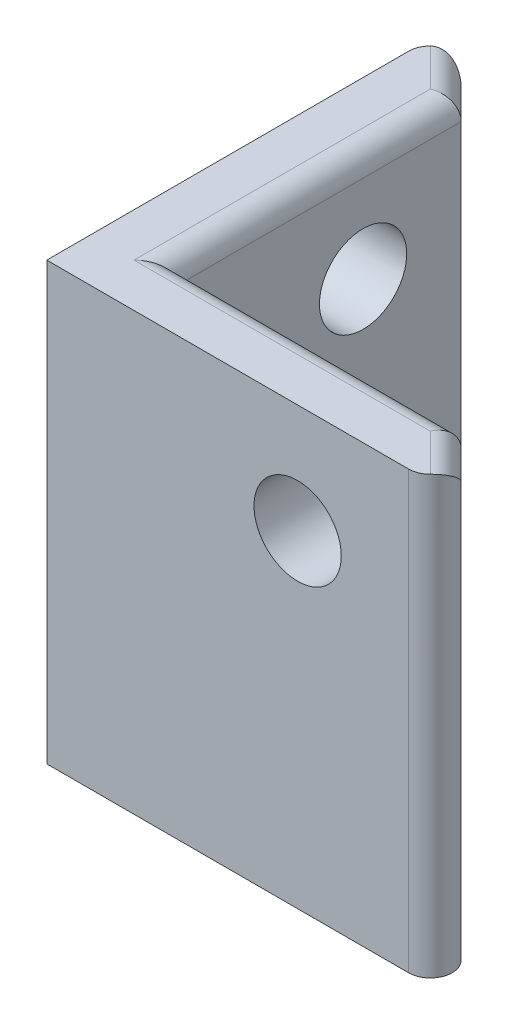
from build123d import *

# Parameters (mm, degrees)
BOSS_EXTRUDE1_DEPTH = 5
BOSS_EXTRUDE2_DEPTH = 15
SKETCH3_R           = 2
CUT_EXTRUDE1_DEPTH  = 34.496268449
SKETCH4_R           = 2
CUT_EXTRUDE2_DEPTH  = 34.496268449
FILLET1_R           = 1


with BuildPart() as part:
    # Sketch1 → Boss-Extrude1 (new body)
    with BuildSketch(Plane(origin=(0, 0, 0), x_dir=(1, 0, 0), z_dir=(0, 1, 0))):
        Polygon((0, 0), (0, 19), (19, 0), align=None)
    extrude(amount=BOSS_EXTRUDE1_DEPTH)

    # Sketch2 → Boss-Extrude2 (add)
    with BuildSketch(Plane(origin=(0, 5, 0), x_dir=(1, 0, 0), z_dir=(0, 1, 0))):
        Polygon((0, 19), (0, 0), (19, 0), (16, 3), (3, 3), (3, 16), align=None)
    extrude(amount=BOSS_EXTRUDE2_DEPTH)

    # Sketch3 → Cut-Extrude1 (cut, through all)
    with BuildSketch(Plane.XY):
        with Locations((11.5, 15)):
            Circle(SKETCH3_R)
    extrude(amount=-CUT_EXTRUDE1_DEPTH, mode=Mode.SUBTRACT)

    # Sketch4 → Cut-Extrude2 (cut, through all)
    with BuildSketch(Plane.ZY):
        with Locations((-11.5, 15)):
            Circle(SKETCH4_R)
    extrude(amount=-CUT_EXTRUDE2_DEPTH, mode=Mode.SUBTRACT)

    # Fillet1
    fillet1_edges = [part.edges().sort_by_distance(p)[0] for p in [
        (9.5, 20, -3),
        (3, 20, -9.5),
        (1.5, 20, -17.5),
        (17.5, 20, -1.5),
        (19, 10, 0),
        (0, 10, -19),
    ]]
    fillet(fillet1_edges, radius=FILLET1_R)


solid = part.part
